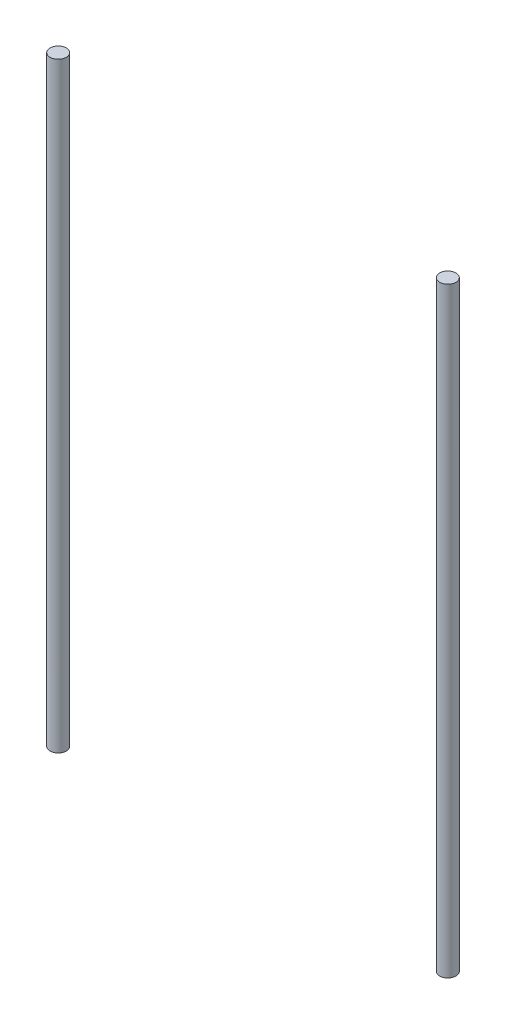
from build123d import *

# Parameters (mm, degrees)
SKETCH1_W                       = 575
SKETCH1_H                       = 940
SKETCH1_W_2                     = 480
SKETCH1_H_2                     = 370
BOSS_EXTRUDE1_DEPTH             = 12
BOSS_EXTRUDE2_REACH             = 553.09
SKETCH2_R                       = 12.7
BOSS_EXTRUDE2_DIRECTION_2_REACH = 553.09
SKETCH3_W                       = 575
SKETCH3_H                       = 940
CUT_EXTRUDE2_DEPTH              = 568.759993307


with BuildPart() as part:
    # Sketch1 → Boss-Extrude1 (new body)
    with BuildSketch(Plane.XY):
        Rectangle(SKETCH1_W, SKETCH1_H)
        with Locations((0, 245)):
            Rectangle(SKETCH1_W_2, SKETCH1_H_2, mode=Mode.SUBTRACT)
    extrude(amount=BOSS_EXTRUDE1_DEPTH)


with BuildPart() as body_2:

    # Boss-Extrude2: up to this face of the body (flat: up to its plane)
    boss_extrude2_end = Plane(part.part.faces().sort_by_distance((0, 470, 6))[0])
    # Sketch2 → Boss-Extrude2 (new, up to the picked face)
    with BuildSketch(Plane(origin=(0, 0, 0), x_dir=(1, 0, 0), z_dir=(0, 1, 0)), mode=Mode.PRIVATE) as boss_extrude2_sk1:
        with Locations(Location((304.8, -12.7, 0), (0, 0, 90))):
            Circle(SKETCH2_R)
    boss_extrude2_tool1 = split(extrude(boss_extrude2_sk1.sketch, amount=BOSS_EXTRUDE2_REACH, mode=Mode.PRIVATE), bisect_by=boss_extrude2_end, keep=Keep.BOTH, mode=Mode.PRIVATE)
    add(boss_extrude2_tool1.solids().sort_by(Axis((304.8, 0, 12.7), (0, 1, 0)))[0])


    # Boss-Extrude2 direction 2: up to this face of the body (flat: up to its plane)
    boss_extrude2_direction_2_end = Plane(part.part.faces().sort_by_distance((0, -470, 6))[0])
    # Sketch2 → Boss-Extrude2 direction 2 (add, up to the picked face)
    with BuildSketch(Plane(origin=(0, 0, 0), x_dir=(1, 0, 0), z_dir=(0, 1, 0)), mode=Mode.PRIVATE) as boss_extrude2_direction_2_sk1:
        with Locations(Location((304.8, -12.7, 0), (0, 0, 90))):
            Circle(SKETCH2_R)
    boss_extrude2_direction_2_tool1 = split(extrude(boss_extrude2_direction_2_sk1.sketch, amount=-BOSS_EXTRUDE2_DIRECTION_2_REACH, mode=Mode.PRIVATE), bisect_by=boss_extrude2_direction_2_end, keep=Keep.BOTH, mode=Mode.PRIVATE)
    add(boss_extrude2_direction_2_tool1.solids().sort_by(Axis((304.8, 0, 12.7), (0, -1, 0)))[0])


with BuildPart() as part_1:
    add(part.part)

    # Sketch3 → Cut-Extrude2 (cut, through all)
    with BuildSketch(Plane.XY):
        Rectangle(SKETCH3_W, SKETCH3_H)
    extrude(amount=CUT_EXTRUDE2_DEPTH, mode=Mode.SUBTRACT)


with BuildPart() as body_2_2:
    # Mirror2: mirrored copy
    add(body_2.part.mirror(Plane(origin=(0, 0, 0), x_dir=(0, 0, 1), z_dir=(1, 0, 0))))


solid = Compound([body_2.part, body_2_2.part])
